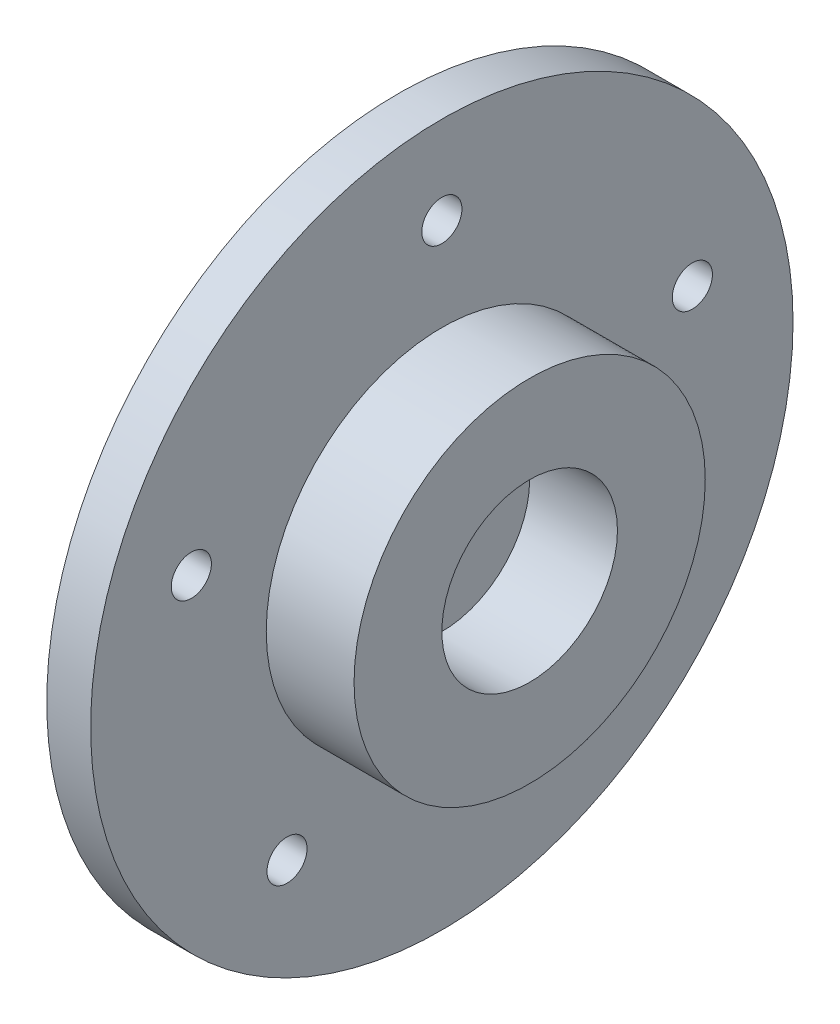
from build123d import *

# Parameters (mm, degrees)
SKETCH1_R           = 50.8
SKETCH1_R_2         = 2.9
BOSS_EXTRUDE1_DEPTH = 6.35
SKETCH2_R           = 25.4
BOSS_EXTRUDE2_DEPTH = 12.7
SKETCH3_R           = 12.7
CUT_EXTRUDE1_DEPTH  = 12.7


with BuildPart() as part:
    # Sketch1 → Boss-Extrude1 (new body)
    with BuildSketch(Plane(origin=(0, 0, 0), x_dir=(0, 0, -1), z_dir=(1, 0, 0))):
        with Locations((0, 0.711302035)):
            Circle(SKETCH1_R)
        with Locations((-36.235253271, 12.484849521)):
            Circle(SKETCH1_R_2, mode=Mode.SUBTRACT)
        with Locations((-22.394618112, -30.112245451)):
            Circle(SKETCH1_R_2, mode=Mode.SUBTRACT)
        with Locations((22.394618112, -30.112245451)):
            Circle(SKETCH1_R_2, mode=Mode.SUBTRACT)
        with Locations((36.235253271, 12.484849521)):
            Circle(SKETCH1_R_2, mode=Mode.SUBTRACT)
        with Locations((0, 38.811302035)):
            Circle(SKETCH1_R_2, mode=Mode.SUBTRACT)
    extrude(amount=BOSS_EXTRUDE1_DEPTH)

    # Sketch2 → Boss-Extrude2 (add)
    with BuildSketch(Plane(origin=(6.35, 0, 0), x_dir=(0, 0, -1), z_dir=(1, 0, 0))):
        Circle(SKETCH2_R)
    extrude(amount=BOSS_EXTRUDE2_DEPTH)

    # Sketch3 → Cut-Extrude1 (cut)
    with BuildSketch(Plane(origin=(19.05, 0, 0), x_dir=(0, 0, -1), z_dir=(1, 0, 0))):
        Circle(SKETCH3_R)
    extrude(amount=-CUT_EXTRUDE1_DEPTH, mode=Mode.SUBTRACT)


solid = part.part
